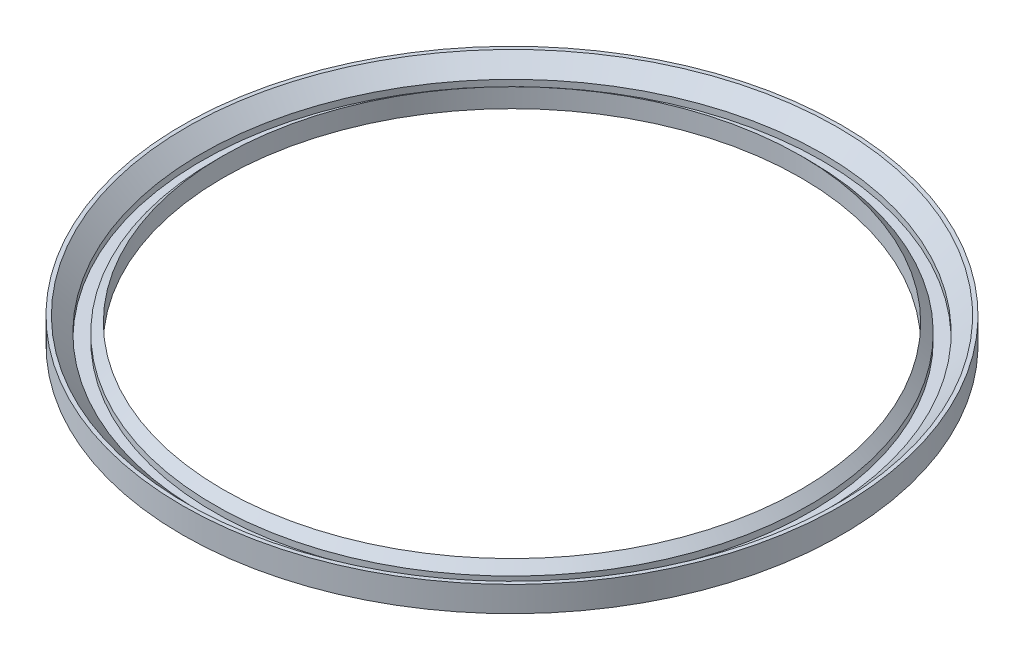
from build123d import *

# Parameters (mm, degrees)
SKETCH1_W = 5
SKETCH1_H = 5


with BuildPart() as part:
    # Sketch1 → Revolve1 (revolve)
    with BuildSketch(Plane.XY):
        with Locations((30, 0)):
            Rectangle(SKETCH1_W, SKETCH1_H)
        Polygon((29.375, -1.496320344), (27.878679656, 0), (29.375, 1.496320344), (29.375, 2.121320344), (30.625, 2.121320344), (30.625, 1.496320344), (32.121320344, 0), (30.625, -1.496320344), (30.625, -2.121320344), (29.375, -2.121320344), align=None, mode=Mode.SUBTRACT)
    revolve(axis=Axis((0, -28.665734922, 0), (0, 1, 0)))

    # Sketch2 → Cut-Revolve1 (revolve, cut)
    with BuildSketch(Plane.XY):
        Polygon((28.5, 0), (32.5, 0), (32.5, 2.5), (27.5, 2.5), (27.5, 0), (27.5, -2.5), (28.5, -2.5), align=None)
    revolve(axis=Axis((0, 0, 0), (0, 1, 0)), mode=Mode.SUBTRACT)


solid = part.part
